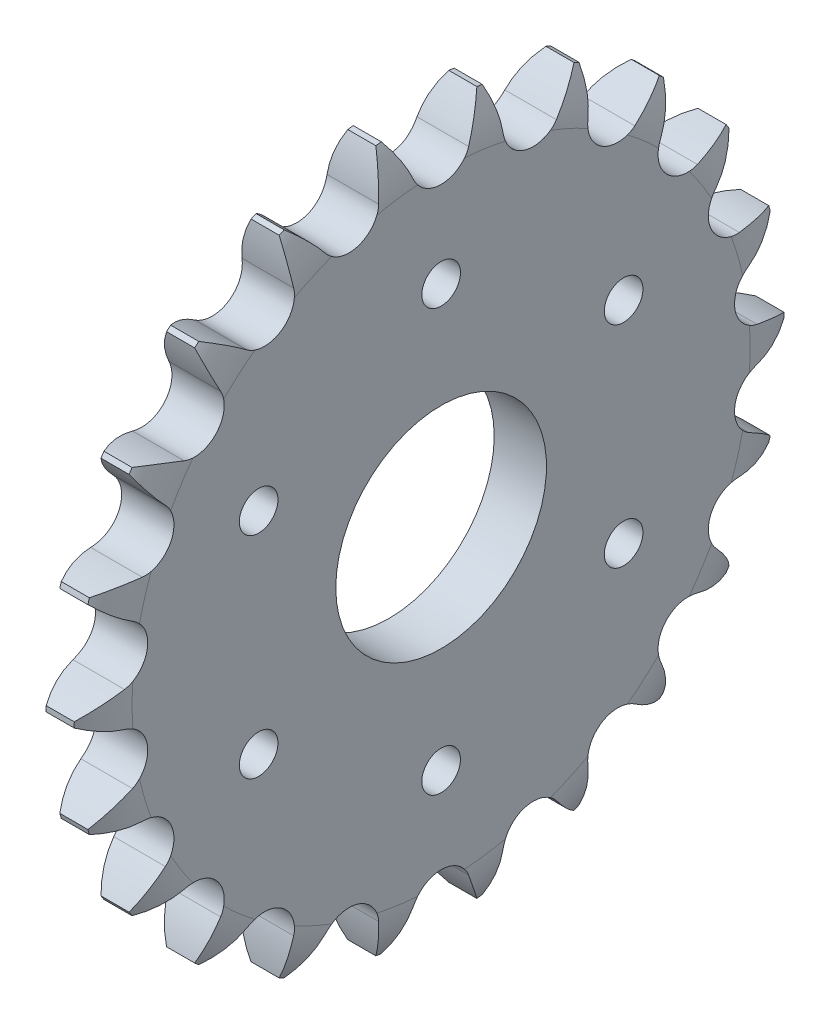
from build123d import *

# Parameters (mm, degrees)
TOOTHCUT_DEPTH              = 87.1879829
TEETHCUTS_COUNT             = 22
TEETHCUTS_ANGLE             = 343.636363636
BORSKE_R                    = 18
BORE_DEPTH                  = 50.0005
RIPETIZIONECIRCOLARE1_COUNT = 6


with BuildPart() as part:
    # BasProSke → Base-Revolve (revolve)
    with BuildSketch(Plane(origin=(0, 0, 0), x_dir=(1, 0, 0), z_dir=(0, 1, 0)), mode=Mode.PRIVATE) as base_revolve_sk:
        with BuildLine():
            Line((0, 0), (0, 52.788905316))
            ThreePointArc((0, 52.788905316), (0.524605563, 56.836252055), (2.06375, 60.616101393))
            Line((2.06375, 60.616101393), (6.86625, 60.616101393))
            ThreePointArc((6.86625, 60.616101393), (8.405394437, 56.836252055), (8.93, 52.788905316))
            Line((8.93, 52.788905316), (8.93, 0))
            Line((8.93, 0), (0, 0))
        make_face()
    revolve(base_revolve_sk.sketch.rotate(Axis((-10, 0, 0), (1, 0, 0)), 180), axis=Axis((-10, 0, 0), (1, 0, 0)))

    # TooCutSke → ToothCut (cut, through all)
    with BuildSketch(Plane(origin=(0, 0, 0), x_dir=(0, 0, -1), z_dir=(1, 0, 0))):
        with BuildLine():
            ThreePointArc((4.755668616, 53.899221457), (6.414109214, 57.332731567), (8.504948237, 60.521431783))
            ThreePointArc((8.504948237, 60.521431783), (0, 61.116101393), (-8.504948237, 60.521431783))
            ThreePointArc((-8.504948237, 60.521431783), (-6.414109214, 57.332731567), (-4.755668616, 53.899221457))
            ThreePointArc((-4.755668616, 53.899221457), (0, 50.694226393), (4.755668616, 53.899221457))
        make_face()
    toothcut = extrude(amount=TOOTHCUT_DEPTH, mode=Mode.SUBTRACT)

    # TeethCuts: ToothCut ×22 about axis
    teethcuts_axis = Axis((-10, 0, 0), (1, 0, 0))
    for i in range(1, TEETHCUTS_COUNT):
        add(toothcut.rotate(teethcuts_axis, i * TEETHCUTS_ANGLE / (TEETHCUTS_COUNT - 1)), mode=Mode.SUBTRACT)

    # BorSke → Bore (cut, symmetric)
    with BuildSketch(Plane(origin=(0, 0, 0), x_dir=(0, 0, -1), z_dir=(1, 0, 0))):
        with Locations(Location((0, 0, 0), (0, 0, 180))):
            Circle(BORSKE_R)
    extrude(amount=BORE_DEPTH, both=True, mode=Mode.SUBTRACT)

    # Schizzo3 → Foro per Vite M6-1 (revolve, cut)
    with BuildSketch(Plane(origin=(8.93, 36, 0), x_dir=(0, 0, -1), z_dir=(0, 1, 0))):
        Polygon((0, 0), (0, 12), (3.3, 10.017159957), (3.3, 0), align=None)
    foro_per_vite_m6_1 = revolve(axis=Axis((15.28, 36, 0), (-1, 0, 0)), mode=Mode.SUBTRACT)

    # RipetizioneCircolare1: Foro per Vite M6-1 ×6 about axis
    ripetizionecircolare1_axis = Axis((0, 0, 0), (1, 0, 0))
    for i in range(1, RIPETIZIONECIRCOLARE1_COUNT):
        add(foro_per_vite_m6_1.rotate(ripetizionecircolare1_axis, i * 360 / RIPETIZIONECIRCOLARE1_COUNT), mode=Mode.SUBTRACT)


solid = part.part
